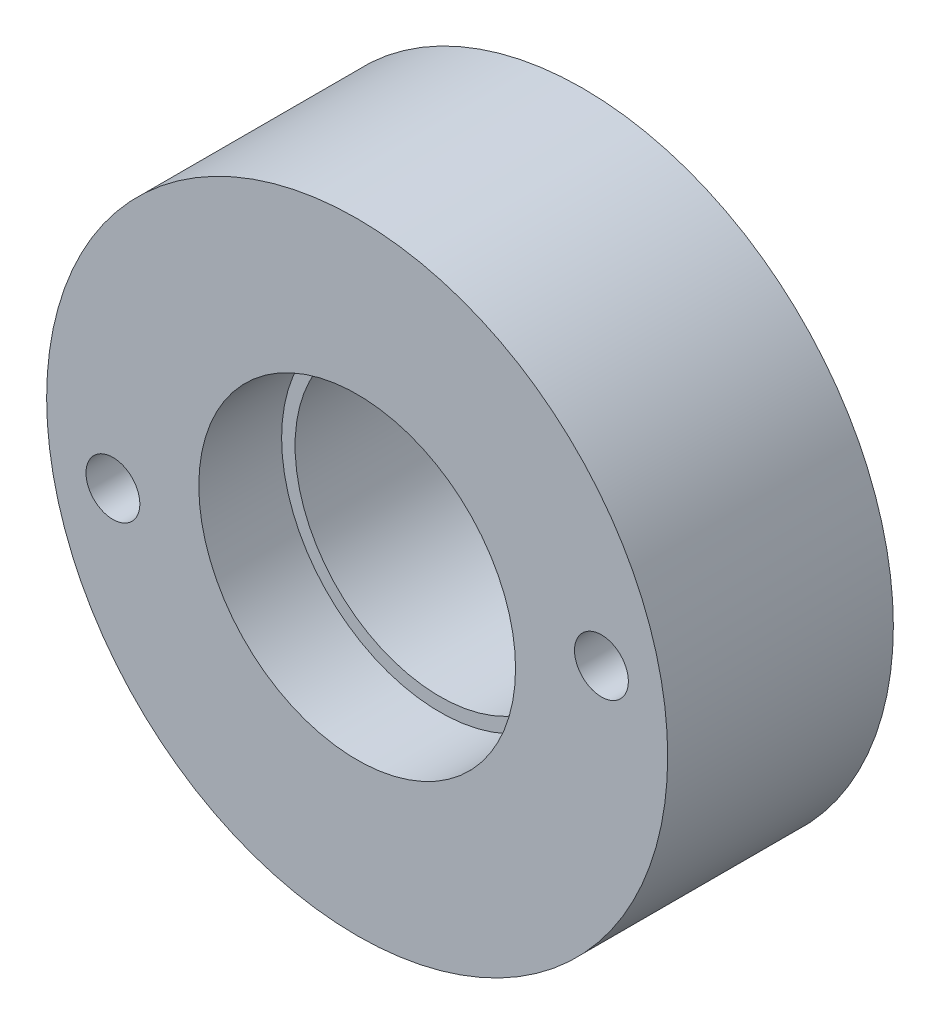
from build123d import *

# Parameters (mm, degrees)
SKETCH_1_R          = 15
SKETCH_1_R_2        = 7
EXTRUDE_1_DEPTH     = 10.9
SKETCH_5_R          = 7.65
CUT_EXTRUDE_3_DEPTH = 4
SKETCH_2_R          = 1.3
CUT_EXTRUDE_4_DEPTH = 24.849737944


with BuildPart() as part:
    # ｽｹｯﾁ1 → ﾎﾞｽ - 押し出し1 (new body)
    with BuildSketch(Plane.XY):
        Circle(SKETCH_1_R)
        Circle(SKETCH_1_R_2, mode=Mode.SUBTRACT)
    extrude(amount=EXTRUDE_1_DEPTH)

    # ｽｹｯﾁ5 → ｶｯﾄ - 押し出し3 (cut)
    with BuildSketch(Plane.XY.offset(10.9)):
        Circle(SKETCH_5_R)
    extrude(amount=-CUT_EXTRUDE_3_DEPTH, mode=Mode.SUBTRACT)

    # ｽｹｯﾁ2 → ｶｯﾄ - 押し出し4 (cut, through all)
    with BuildSketch(Plane(origin=(0, 0, 0), x_dir=(-1, 0, 0), z_dir=(0, 0, -1))):
        with Locations((-11.798830207, 2.188059811)):
            Circle(SKETCH_2_R)
        with Locations((11.798830207, -2.188059811)):
            Circle(SKETCH_2_R)
    extrude(amount=-CUT_EXTRUDE_4_DEPTH, mode=Mode.SUBTRACT)


solid = part.part
